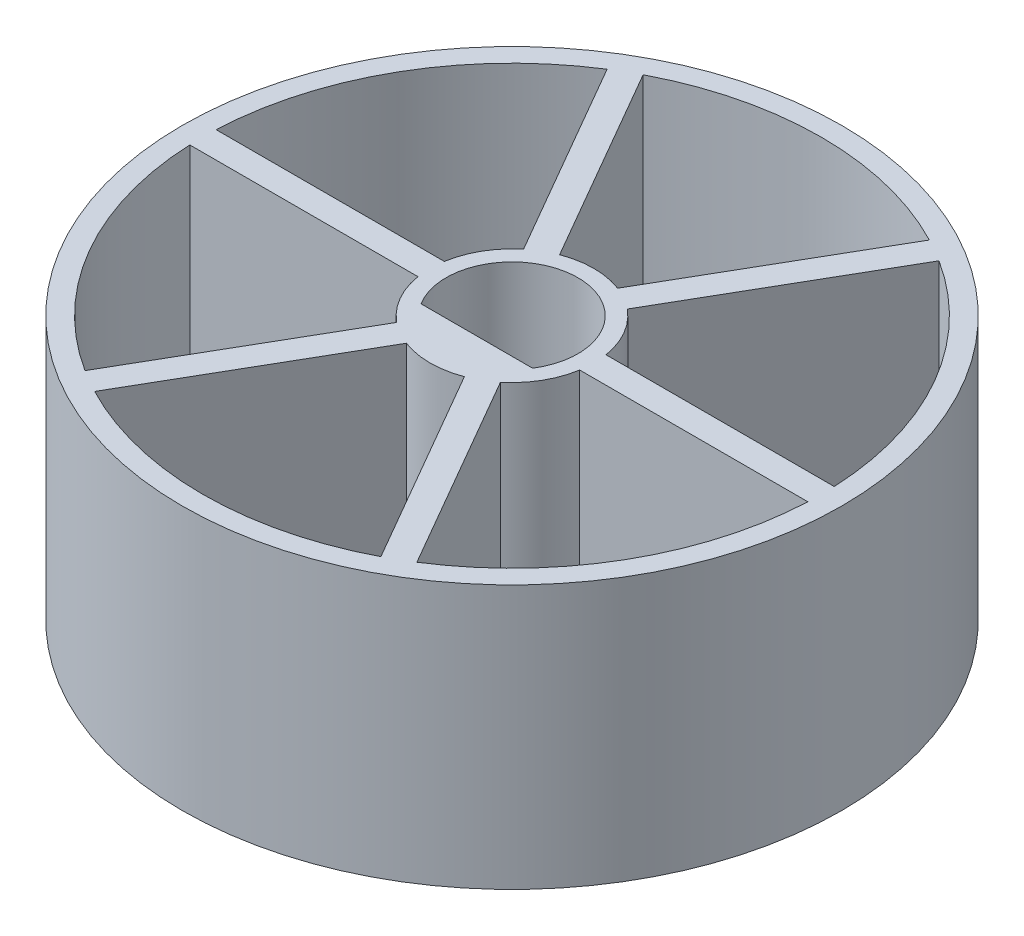
from build123d import *

# Parameters (mm, degrees)
IZIM1_R                     = 37.5
Y_KSEKLIK_EKSTR_ZYON1_DEPTH = 30


with BuildPart() as part:
    # Çizim1 → Yükseklik-Ekstrüzyon1 (new body)
    with BuildSketch(Plane(origin=(0, 0, 0), x_dir=(1, 0, 0), z_dir=(0, 1, 0))):
        with Locations(Location((0, 0, 0), (0, 0, 270))):
            Circle(IZIM1_R)
        with BuildLine():
            ThreePointArc((-18.874079265, -29.690864233), (-30.468569301, -17.591036688), (-35.150082319, -1.5))
            Line((-35.150082319, -1.5), (-9.196399109, -1.5))
            ThreePointArc((-9.196399109, -1.5), (-8.069561167, -4.658963312), (-5.89723766, -7.214315252))
            Line((-5.89723766, -7.214315252), (-18.874079265, -29.690864233))
        make_face(mode=Mode.SUBTRACT)
        with BuildLine():
            Line((3.299161449, -8.714315252), (16.276003054, -31.190864233))
            ThreePointArc((16.276003054, -31.190864233), (0, -35.182073376), (-16.276003054, -31.190864233))
            Line((-16.276003054, -31.190864233), (-3.299161449, -8.714315252))
            ThreePointArc((-3.299161449, -8.714315252), (0, -9.317926624), (3.299161449, -8.714315252))
        make_face(mode=Mode.SUBTRACT)
        with BuildLine():
            Line((9.196399109, -1.5), (35.150082319, -1.5))
            ThreePointArc((35.150082319, -1.5), (30.468569301, -17.591036688), (18.874079265, -29.690864233))
            Line((18.874079265, -29.690864233), (5.89723766, -7.214315252))
            ThreePointArc((5.89723766, -7.214315252), (8.069561167, -4.658963312), (9.196399109, -1.5))
        make_face(mode=Mode.SUBTRACT)
        with BuildLine():
            ThreePointArc((-35.150082319, 1.5), (-30.468569301, 17.591036688), (-18.874079265, 29.690864233))
            Line((-18.874079265, 29.690864233), (-5.89723766, 7.214315252))
            ThreePointArc((-5.89723766, 7.214315252), (-8.069561167, 4.658963312), (-9.196399109, 1.5))
            Line((-9.196399109, 1.5), (-35.150082319, 1.5))
        make_face(mode=Mode.SUBTRACT)
        with BuildLine():
            Line((6.34428877, -4), (-6.34428877, -4))
            ThreePointArc((-6.34428877, -4), (0, 7.5), (6.34428877, -4))
        make_face(mode=Mode.SUBTRACT)
        with BuildLine():
            Line((5.89723766, 7.214315252), (18.874079265, 29.690864233))
            ThreePointArc((18.874079265, 29.690864233), (30.468569301, 17.591036688), (35.150082319, 1.5))
            Line((35.150082319, 1.5), (9.196399109, 1.5))
            ThreePointArc((9.196399109, 1.5), (8.069561167, 4.658963312), (5.89723766, 7.214315252))
        make_face(mode=Mode.SUBTRACT)
        with BuildLine():
            Line((-3.299161449, 8.714315252), (-16.276003054, 31.190864233))
            ThreePointArc((-16.276003054, 31.190864233), (0, 35.182073376), (16.276003054, 31.190864233))
            Line((16.276003054, 31.190864233), (3.299161449, 8.714315252))
            ThreePointArc((3.299161449, 8.714315252), (0, 9.317926624), (-3.299161449, 8.714315252))
        make_face(mode=Mode.SUBTRACT)
    extrude(amount=Y_KSEKLIK_EKSTR_ZYON1_DEPTH)


solid = part.part
